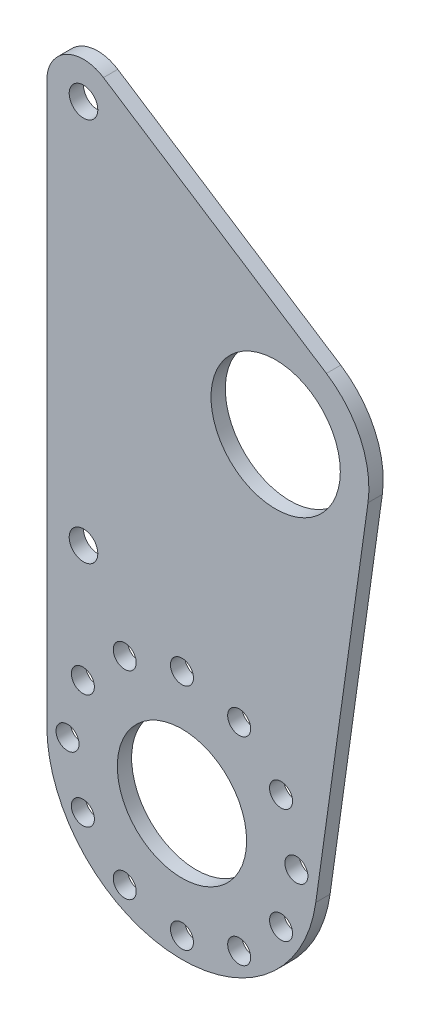
from build123d import *

# Parameters (mm, degrees)
SKETCH2_R           = 14.351
SKETCH2_R_2         = 2.5527
SKETCH2_R_3         = 3.175
BOSS_EXTRUDE1_DEPTH = 3.175


with BuildPart() as part:
    # Sketch2 → Boss-Extrude1 (new body)
    with BuildSketch(Plane.XY):
        with BuildLine():
            Line((-139.7, 154.014440652), (-139.7, 30))
            ThreePointArc((-139.7, 30), (-111.788337372, 0.072774151), (-79.990743532, 25.833457055))
            Line((-79.990743532, 25.833457055), (-68.399622728, 108.48317056))
            ThreePointArc((-68.399622728, 108.48317056), (-70.065229263, 119.947916289), (-77.629824678, 128.72239838))
            Line((-77.629824678, 128.72239838), (-127.122524146, 160.845515232))
            ThreePointArc((-127.122524146, 160.845515232), (-135.443000435, 161.170844756), (-139.7, 154.014440652))
        make_face()
        with Locations((-88.9, 111.358224077)):
            Circle(SKETCH2_R, mode=Mode.SUBTRACT)
        with Locations((-109.7, 55.4)):
            Circle(SKETCH2_R_2, mode=Mode.SUBTRACT)
        with Locations((-97, 51.997045256)):
            Circle(SKETCH2_R_2, mode=Mode.SUBTRACT)
        with Locations((-87.702954744, 42.7)):
            Circle(SKETCH2_R_2, mode=Mode.SUBTRACT)
        with Locations((-84.3, 30)):
            Circle(SKETCH2_R_2, mode=Mode.SUBTRACT)
        with Locations((-87.702954744, 17.3)):
            Circle(SKETCH2_R_2, mode=Mode.SUBTRACT)
        with Locations((-97, 8.002954744)):
            Circle(SKETCH2_R_2, mode=Mode.SUBTRACT)
        with Locations((-109.7, 4.6)):
            Circle(SKETCH2_R_2, mode=Mode.SUBTRACT)
        with Locations((-122.4, 8.002954744)):
            Circle(SKETCH2_R_2, mode=Mode.SUBTRACT)
        with Locations((-131.697045256, 17.3)):
            Circle(SKETCH2_R_2, mode=Mode.SUBTRACT)
        with Locations((-135.1, 30)):
            Circle(SKETCH2_R_2, mode=Mode.SUBTRACT)
        with Locations((-131.697045256, 42.7)):
            Circle(SKETCH2_R_2, mode=Mode.SUBTRACT)
        with Locations((-122.4, 51.997045256)):
            Circle(SKETCH2_R_2, mode=Mode.SUBTRACT)
        with Locations((-109.7, 30)):
            Circle(SKETCH2_R, mode=Mode.SUBTRACT)
        with Locations((-131.556216575, 68.702007502)):
            Circle(SKETCH2_R_3, mode=Mode.SUBTRACT)
        with Locations((-131.556216575, 154.014440652)):
            Circle(SKETCH2_R_3, mode=Mode.SUBTRACT)
    extrude(amount=BOSS_EXTRUDE1_DEPTH)


solid = part.part
